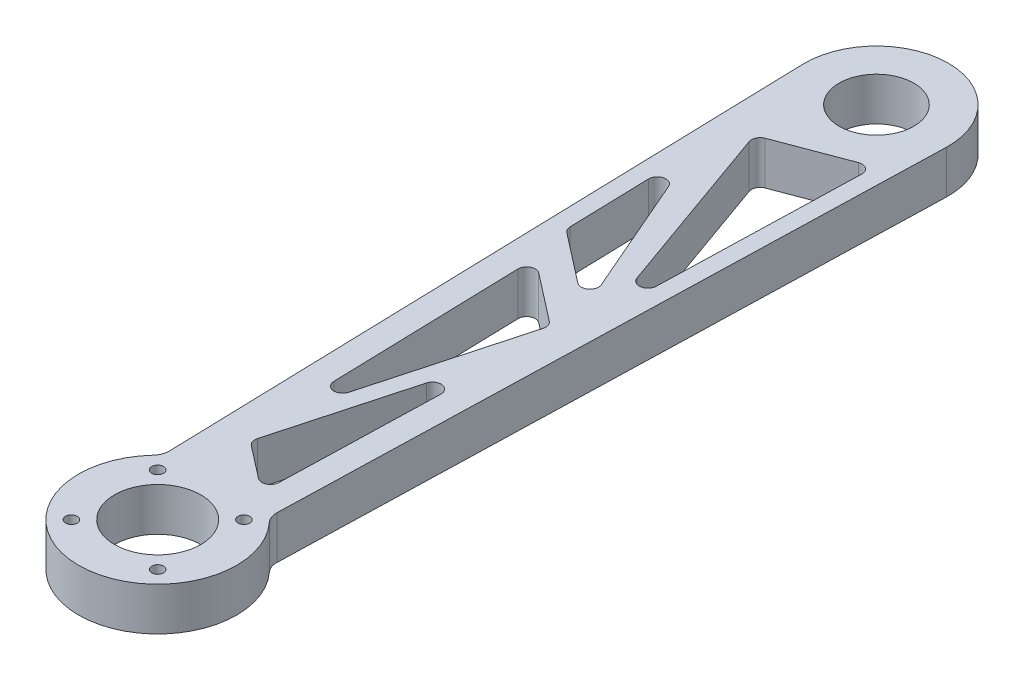
from build123d import *

# Parameters (mm, degrees)
SKETCH_1_R          = 5.05
SKETCH_1_R_2        = 13
EXTRUDE_1_DEPTH     = 15
FILLET_1_R          = 3
CUT_EXTRUDE_3_DEPTH = 277.54113618
FILLET_2_R          = 3
EXTRUDE_START       = -15
SKETCH_5_R          = 27.5
SKETCH_5_R_2        = 5.05
EXTRUDE_2_DEPTH     = 15
FILLET_3_R          = 6
EXTRUDE_3_DEPTH     = 15
FILLET_4_R          = 3
SKETCH_7_R          = 2.05
CUT_EXTRUDE_4_DEPTH = 277.778340916
SKETCH_8_R          = 15
CUT_EXTRUDE_5_DEPTH = 277.778340916


with BuildPart() as part:
    # 草图1 → 凸台-拉伸1 (new body)
    with BuildSketch(Plane(origin=(0, 0, 0), x_dir=(1, 0, 0), z_dir=(0, 1, 0))):
        with BuildLine():
            Line((-17.992942616, -0.504), (-24.990198078, 249.3))
            ThreePointArc((-24.990198078, 249.3), (0, 275), (24.990198078, 249.3))
            Line((24.990198078, 249.3), (17.992942616, -0.504))
            ThreePointArc((17.992942616, -0.504), (0, -18), (-17.992942616, -0.504))
        make_face()
        with Locations(Location((0, 0, 0), (0, 0, 270))):
            Circle(SKETCH_1_R, mode=Mode.SUBTRACT)
        with Locations(Location((0, 250, 0), (0, 0, 270))):
            Circle(SKETCH_1_R_2, mode=Mode.SUBTRACT)
        Polygon((-16.444447487, 158.5), (-17.704941698, 203.5), (11.028871219, 137.174942267), align=None, mode=Mode.SUBTRACT)
        Polygon((15.954255294, 141), (18.475243716, 231), (-12, 219.5), align=None, mode=Mode.SUBTRACT)
    extrude(amount=EXTRUDE_1_DEPTH)

    # 圆角1
    fillet_1_edges = [part.edges().sort_by_distance(p)[0] for p in [
        (-16.444447487, 7.5, -158.5),
        (11.028871219, 7.5, -137.174942267),
        (-17.704941698, 7.5, -203.5),
        (18.475243716, 7.5, -231),
        (-12, 7.5, -219.5),
        (15.954255294, 7.5, -141),
    ]]
    fillet(fillet_1_edges, radius=FILLET_1_R)

    # 草图4 → 切除-拉伸3 (cut, through all)
    with BuildSketch(Plane(origin=(0, 15, 0), x_dir=(1, 0, 0), z_dir=(0, 1, 0))):
        Polygon((-13.050343026, 144.472367448), (12.494927596, 124.643879429), (9.742058902, 26.365688077), (-10.175105816, 41.825585442), align=None)
    extrude(amount=-CUT_EXTRUDE_3_DEPTH, mode=Mode.SUBTRACT)

    # 圆角2
    fillet_2_edges = [part.edges().sort_by_distance(p)[0] for p in [
        (-10.175105816, 7.5, -41.825585442),
        (-13.050343026, 7.5, -144.472367448),
        (9.742058902, 7.5, -26.365688077),
    ]]
    fillet(fillet_2_edges, radius=FILLET_2_R)

    # 草图5 → 凸台-拉伸2 (add)
    with BuildSketch(Plane(origin=(0, 15, 0), x_dir=(1, 0, 0), z_dir=(0, 1, 0)).offset(EXTRUDE_START)):
        Circle(SKETCH_5_R)
        with Locations(Location((0, 0, 0), (0, 0, 270))):
            Circle(SKETCH_5_R_2, mode=Mode.SUBTRACT)
    extrude(amount=EXTRUDE_2_DEPTH)

    # 圆角3
    fillet_3_edges = [part.edges().sort_by_distance(p)[0] for p in [
        (-18.575080057, 7.5, -20.278471364),
        (18.575080057, 7.5, -20.278471364),
    ]]
    fillet(fillet_3_edges, radius=FILLET_3_R)

    # 草图6 → 凸台-拉伸3 (add)
    with BuildSketch(Plane(origin=(0, 15, 0), x_dir=(1, 0, 0), z_dir=(0, 1, 0))):
        Polygon((9.60137553, 125.435937788), (-13.068657882, 42.617643801), (-7.609801347, 39.834371112), (-7.28155375, 41.033527083), (15.388479662, 123.85182107), (9.929623127, 126.635093759), align=None)
    extrude(amount=-EXTRUDE_3_DEPTH)

    # 圆角4
    fillet_4_edges = [part.edges().sort_by_distance(p)[0] for p in [
        (9.929623127, 7.5, -126.635093759),
        (12.14036175, 7.5, -111.985778385),
        (-7.609801347, 7.5, -39.834371112),
        (-10.463842583, 7.5, -52.133569747),
    ]]
    fillet(fillet_4_edges, radius=FILLET_4_R)

    # 草图7 → 切除-拉伸4 (cut, through all)
    with BuildSketch(Plane(origin=(0, 15, 0), x_dir=(1, 0, 0), z_dir=(0, 1, 0))):
        with Locations(Location((15, 15, 0), (0, 0, 270))):
            Circle(SKETCH_7_R)
        with Locations(Location((-15, 15, 0), (0, 0, 270))):
            Circle(SKETCH_7_R)
        with Locations(Location((-15, -15, 0), (0, 0, 270))):
            Circle(SKETCH_7_R)
        with Locations(Location((15, -15, 0), (0, 0, 270))):
            Circle(SKETCH_7_R)
    extrude(amount=-CUT_EXTRUDE_4_DEPTH, mode=Mode.SUBTRACT)

    # 草图8 → 切除-拉伸5 (cut, through all)
    with BuildSketch(Plane(origin=(0, 15, 0), x_dir=(1, 0, 0), z_dir=(0, 1, 0))):
        with Locations(Location((0, 0, 0), (0, 0, 270))):
            Circle(SKETCH_8_R)
    extrude(amount=-CUT_EXTRUDE_5_DEPTH, mode=Mode.SUBTRACT)


solid = part.part
